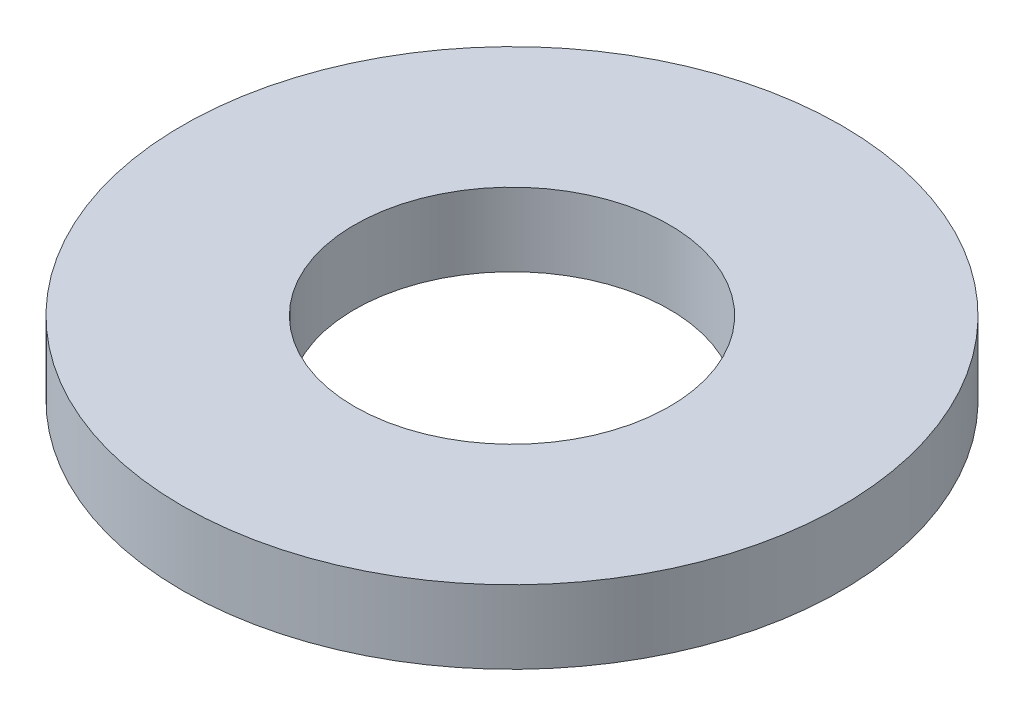
from build123d import *

# Parameters (mm, degrees)
SKETCH2_R           = 4.5
SKETCH2_R_2         = 2.15
BOSS_EXTRUDE1_DEPTH = 1


with BuildPart() as part:
    # Sketch2 → Boss-Extrude1 (new body)
    with BuildSketch(Plane(origin=(0, 0, 0), x_dir=(1, 0, 0), z_dir=(0, 1, 0))):
        with Locations(Location((0, 0, 0), (0, 0, 270))):
            Circle(SKETCH2_R)
        with Locations(Location((0, 0, 0), (0, 0, 270))):
            Circle(SKETCH2_R_2, mode=Mode.SUBTRACT)
    extrude(amount=BOSS_EXTRUDE1_DEPTH)


solid = part.part
